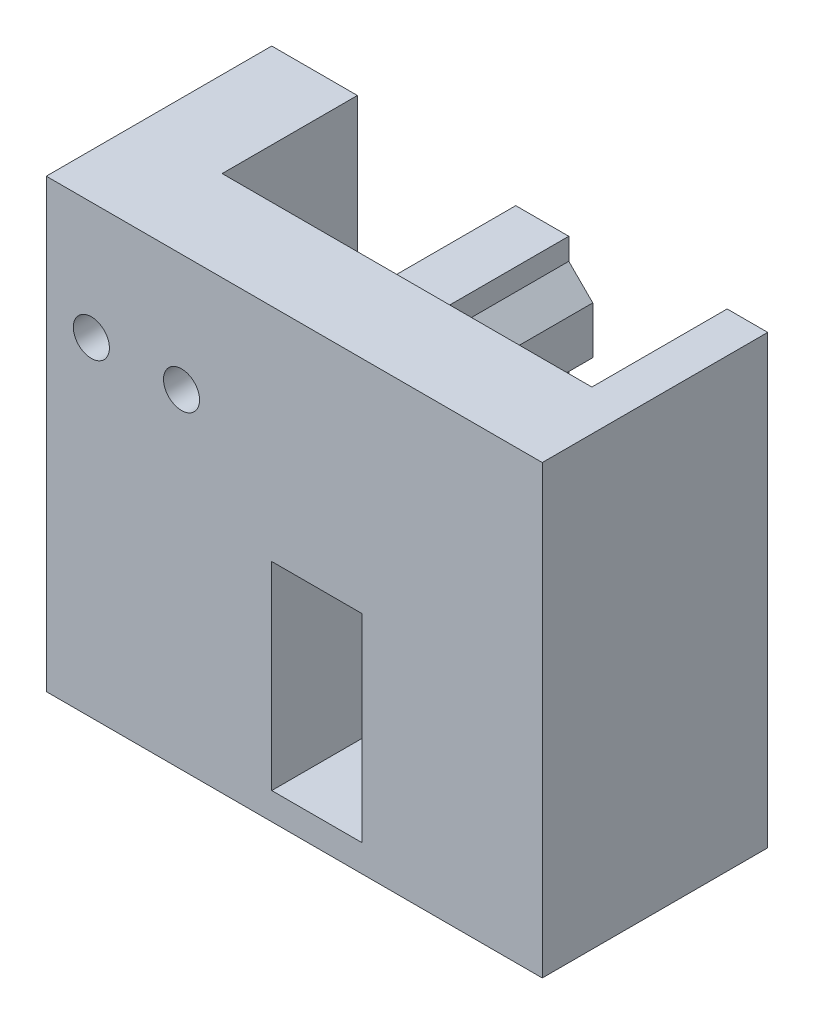
from build123d import *

# Parameters (mm, degrees)
BOSS_EXTRUDE1_DEPTH = 15
SKETCH3_W           = 55
SKETCH3_H           = 49.5
BOSS_EXTRUDE2_DEPTH = 10
BOSS_EXTRUDE3_DEPTH = 15
SKETCH5_R           = 2
CUT_EXTRUDE1_DEPTH  = 7
SKETCH6_R           = 2
CUT_EXTRUDE2_DEPTH  = 7
SKETCH7_W           = 10
SKETCH7_H           = 22
CUT_EXTRUDE3_DEPTH  = 43


with BuildPart() as part:
    # Sketch1 → Boss-Extrude1 (new body)
    with BuildSketch(Plane.XY):
        Polygon((15, -20), (-40, -20), (-40, 29.5), (-30.5, 29.5), (-30.5, 10), (-30.5, 3.494427191), (-29.7, 2.6), (-27.7, 2.6), (-27.7, 5), (-26.767766953, 5), (-24.4, 2.632233047), (-24.4, -2.783060843), (-26.767766953, -5), (-27.7, -5), (-27.7, -2.6), (-29.7, -2.6), (-30.5, -3.494427191), (-30.5, -10.5), (10.5, -10.5), (10.5, -3.494427191), (9.7, -2.6), (7.7, -2.6), (7.7, -5), (6.767766953, -5), (4.4, -2.783060843), (4.4, 2.632233047), (6.767766953, 5), (7.7, 5), (7.7, 2.6), (9.7, 2.6), (10.5, 3.494427191), (10.5, 10), (10.5, 29.5), (15, 29.5), align=None)
    extrude(amount=-BOSS_EXTRUDE1_DEPTH)

    # Sketch3 → Boss-Extrude2 (add)
    with BuildSketch(Plane.XY):
        with Locations((-12.5, 4.75)):
            Rectangle(SKETCH3_W, SKETCH3_H)
    extrude(amount=BOSS_EXTRUDE2_DEPTH)

    # Sketch5 → Cut-Extrude1 (cut)
    with BuildSketch(Plane.XY.offset(10)):
        with Locations((-35, 16.5)):
            Circle(SKETCH5_R)
        with Locations((-25, 16.5)):
            Circle(SKETCH5_R)
    extrude(amount=-CUT_EXTRUDE1_DEPTH, mode=Mode.SUBTRACT)

    # Sketch6 → Cut-Extrude2 (cut)
    with BuildSketch(Plane(origin=(0, -20, 0), x_dir=(-1, 0, 0), z_dir=(0, -1, 0))):
        with Locations(Location((35, -1, 0), (0, 0, 180))):
            Circle(SKETCH6_R)
    extrude(amount=-CUT_EXTRUDE2_DEPTH, mode=Mode.SUBTRACT)

    # Sketch7 → Cut-Extrude3 (cut)
    with BuildSketch(Plane.XY.offset(10)):
        with Locations((-10, -6)):
            Rectangle(SKETCH7_W, SKETCH7_H)
    extrude(amount=-CUT_EXTRUDE3_DEPTH, mode=Mode.SUBTRACT)


with BuildPart() as body_2:
    # Sketch4 → Boss-Extrude3 (new body)
    with BuildSketch(Plane(origin=(0, 0, 0), x_dir=(-1, 0, 0), z_dir=(0, 0, -1))):
        Polygon((12.939339828, 25.292893219), (15.6, 22.632233047), (15.6, 17.367766953), (12.939339828, 14.707106781), (12.939339828, 12.3), (7.060660172, 12.3), (7.060660172, 14.707106781), (4.4, 17.367766953), (4.4, 22.632233047), (7.060660172, 25.292893219), (7.060660172, 27.7), (12.939339828, 27.7), align=None)
    extrude(amount=BOSS_EXTRUDE3_DEPTH)


solid = Compound([part.part, body_2.part])
